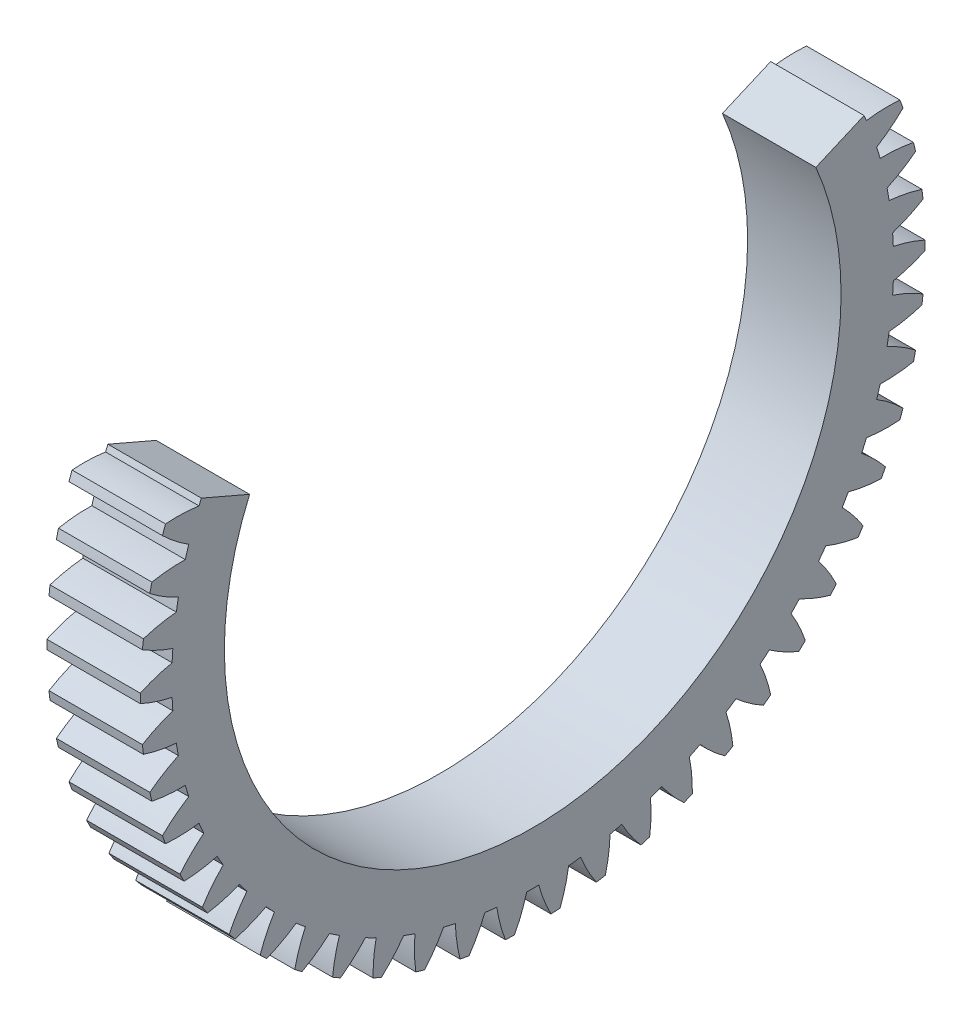
from build123d import *

# Parameters (mm, degrees)
BASPROSKE_W        = 10
BASPROSKE_H        = 42
TOOTHCUT_DEPTH     = 61.232881385
TEETHCUTS_COUNT    = 54
TEETHCUTS_ANGLE    = 353.333333333
BORSKE_R           = 33
BORE_DEPTH         = 50.0000508
CUT_EXTRUDE1_DEPTH = 61.201113015


with BuildPart() as part:
    # BasProSke → Base-Revolve (revolve)
    with BuildSketch(Plane(origin=(0, 0, 0), x_dir=(1, 0, 0), z_dir=(0, 1, 0)), mode=Mode.PRIVATE) as base_revolve_sk:
        with Locations((5, 21)):
            Rectangle(BASPROSKE_W, BASPROSKE_H)
    revolve(base_revolve_sk.sketch.rotate(Axis((-10, 0, 0), (1, 0, 0)), 180), axis=Axis((-10, 0, 0), (1, 0, 0)))

    # TooCutSke → ToothCut (cut, through all)
    with BuildSketch(Plane(origin=(0, 0, 0), x_dir=(0, 0, -1), z_dir=(1, 0, 0))):
        with BuildLine():
            ThreePointArc((0.644971103, 38.618614531), (0, 38.624), (-0.644971103, 38.618614531))
            ThreePointArc((-0.644971103, 38.618614531), (-1.213092784, 40.335949475), (-1.96912885, 41.979242212))
            ThreePointArc((-1.96912885, 41.979242212), (0, 42.0254), (1.96912885, 41.979242212))
            ThreePointArc((1.96912885, 41.979242212), (1.213092784, 40.335949475), (0.644971103, 38.618614531))
        make_face()
    toothcut = extrude(amount=TOOTHCUT_DEPTH, mode=Mode.SUBTRACT)

    # TeethCuts: ToothCut ×54 about axis
    teethcuts_axis = Axis((-10, 0, 0), (1, 0, 0))
    for i in range(1, TEETHCUTS_COUNT):
        add(toothcut.rotate(teethcuts_axis, i * TEETHCUTS_ANGLE / (TEETHCUTS_COUNT - 1)), mode=Mode.SUBTRACT)

    # BorSke → Bore (cut, symmetric)
    with BuildSketch(Plane(origin=(0, 0, 0), x_dir=(0, 0, -1), z_dir=(1, 0, 0))):
        with Locations(Location((0, 0, 0), (0, 0, 180))):
            Circle(BORSKE_R)
    extrude(amount=BORE_DEPTH, both=True, mode=Mode.SUBTRACT)

    # Sketch1 → Cut-Extrude1 (cut, through all)
    with BuildSketch(Plane.ZY):
        with BuildLine():
            Line((30.301131527, 13.070632279), (39.483292596, 17.03142994))
            ThreePointArc((39.483292596, 17.03142994), (0, 43), (-39.483292596, 17.03142994))
            Line((-39.483292596, 17.03142994), (-30.301131527, 13.070632279))
            ThreePointArc((-30.301131527, 13.070632279), (0, 33), (30.301131527, 13.070632279))
        make_face()
    extrude(amount=-CUT_EXTRUDE1_DEPTH, mode=Mode.SUBTRACT)


solid = part.part
